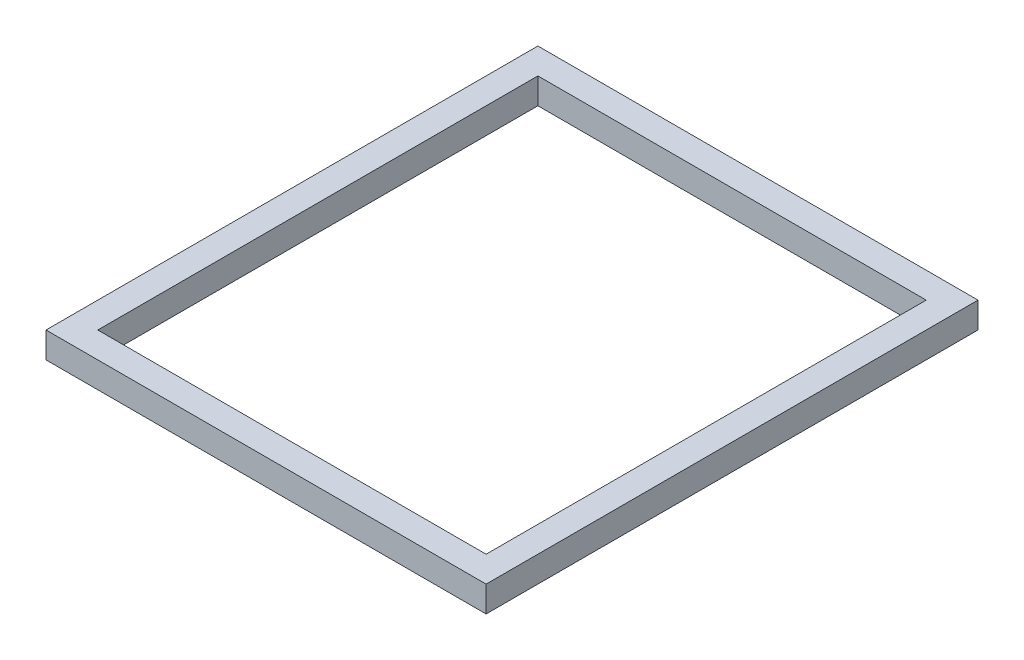
from build123d import *

# Parameters (mm, degrees)
SKETCH1_W           = 107.95
SKETCH1_H           = 120.65
SKETCH1_W_2         = 95.25
SKETCH1_H_2         = 107.95
BOSS_EXTRUDE1_DEPTH = 6.35


with BuildPart() as part:
    # Sketch1 → Boss-Extrude1 (new body)
    with BuildSketch(Plane(origin=(0, 0, 0), x_dir=(1, 0, 0), z_dir=(0, 1, 0))):
        Rectangle(SKETCH1_W, SKETCH1_H)
        Rectangle(SKETCH1_W_2, SKETCH1_H_2, mode=Mode.SUBTRACT)
    extrude(amount=BOSS_EXTRUDE1_DEPTH)


solid = part.part
